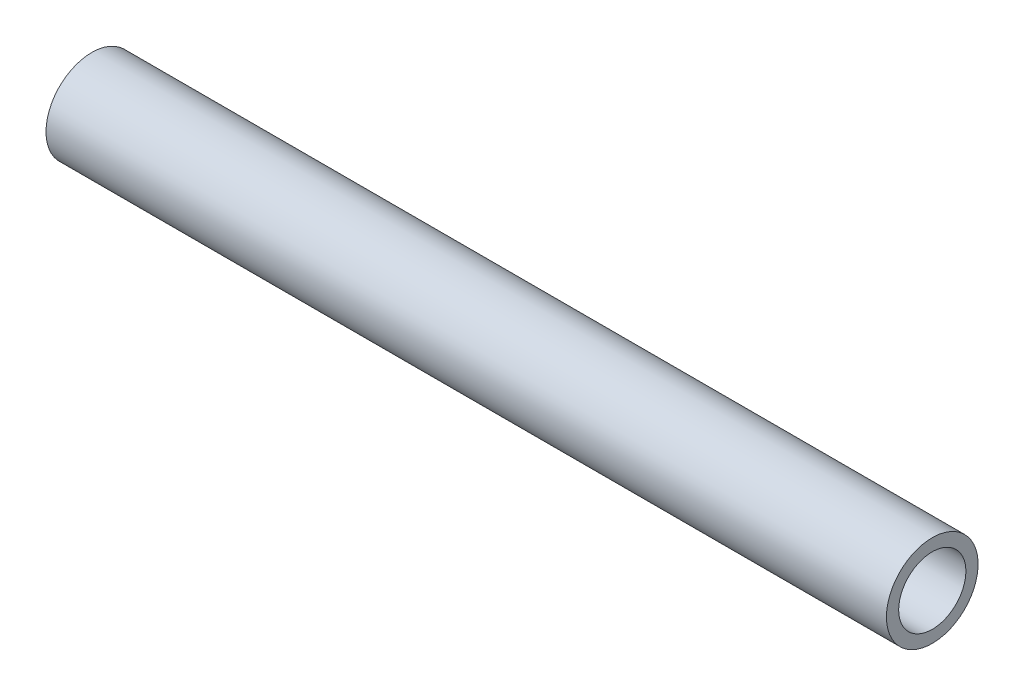
from build123d import *

# Parameters (mm, degrees)
AXIAL_PROFILE_MM_W = 41.266688464
AXIAL_PROFILE_MM_H = 0.6


with BuildPart() as part:
    # Axial profile (mm) → Full revolution (revolve)
    with BuildSketch(Plane.XY, mode=Mode.PRIVATE) as full_revolution_sk:
        with Locations((20.633344232, 1.95)):
            Rectangle(AXIAL_PROFILE_MM_W, AXIAL_PROFILE_MM_H)
    revolve(full_revolution_sk.sketch.rotate(Axis((-110, 0, 0), (1, 0, 0)), 90), axis=Axis((-110, 0, 0), (1, 0, 0)))


solid = part.part
